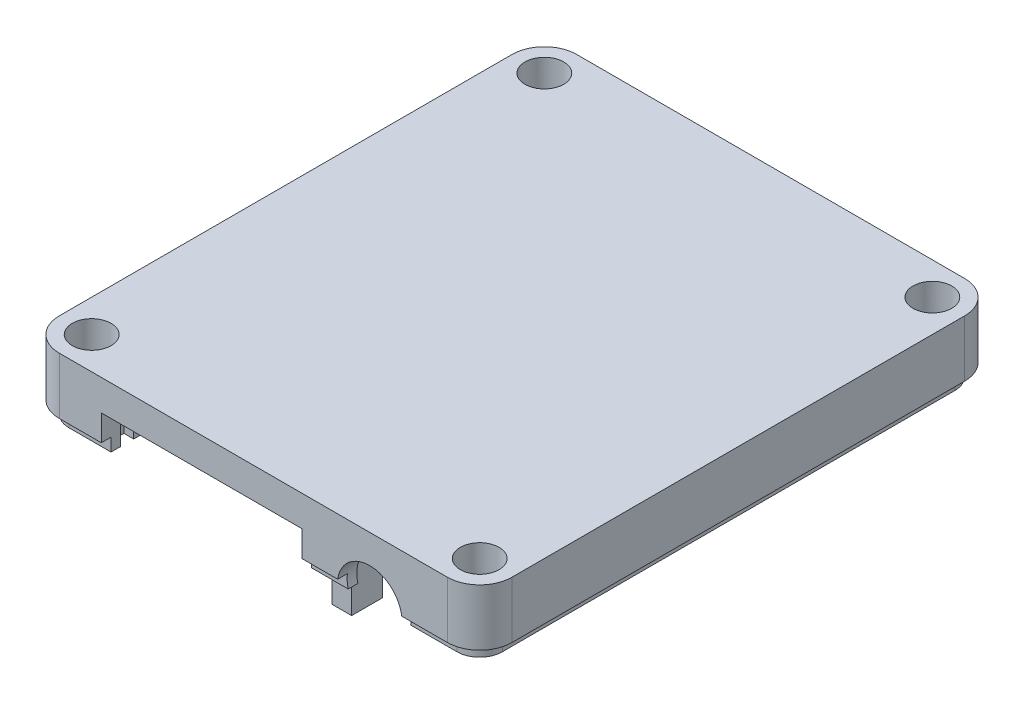
from build123d import *

# Parameters (mm, degrees)
SKETCH1_W              = 70
SKETCH1_H              = 80
BOSS_EXTRUDE1_DEPTH    = 21.5
FILLET1_R              = 5
SHELL1_T               = 3
BOSS_EXTRUDE2_REACH    = 59.335
SKETCH3_R              = 5
SPLIT2_SURFACE_1_BACK  = 109.454
SPLIT2_SURFACE_1_DEPTH = 218.908
SPLIT2_SURFACE_2_BACK  = 109.454
SPLIT2_SURFACE_2_DEPTH = 218.908
SKETCH4_R              = 1
CUT_EXTRUDE1_DEPTH     = 58.334544561
SKETCH6_OUTSIDE_W      = 93.69
SKETCH6_OUTSIDE_H      = 103.69
CUT_EXTRUDE3_DEPTH     = 2
BOSS_EXTRUDE3_START    = 1.8
BOSS_EXTRUDE3_DEPTH    = 1.8
SKETCH8_R              = 5.5
CUT_EXTRUDE4_DEPTH     = 10
SKETCH9_R              = 5
SKETCH9_W              = 20
SKETCH9_H              = 12
CUT_EXTRUDE5_DEPTH     = 10
BOSS_EXTRUDE4_DEPTH    = 7.75
SKETCH5_R              = 3
CUT_EXTRUDE2_DEPTH     = 7.75
SKETCH12_W             = 31
SKETCH12_H             = 12
CUT_EXTRUDE6_DEPTH     = 10
BOSS_EXTRUDE5_DEPTH    = 5


with BuildPart() as part:
    # Sketch1 → Boss-Extrude1 (new body)
    with BuildSketch(Plane(origin=(0, 0, 0), x_dir=(1, 0, 0), z_dir=(0, 1, 0))):
        Rectangle(SKETCH1_W, SKETCH1_H)
    extrude(amount=BOSS_EXTRUDE1_DEPTH)

    # Fillet1
    fillet1_edges = [part.edges().sort_by_distance(p)[0] for p in [
        (-35, 10.75, -40),
        (35, 10.75, -40),
        (35, 10.75, 40),
        (-35, 10.75, 40),
    ]]
    fillet(fillet1_edges, radius=FILLET1_R)

    # Shell1 (no face opened: a closed hollow body)
    add(offset(amount=-SHELL1_T, mode=Mode.PRIVATE), mode=Mode.SUBTRACT)

    # Sketch3 → Boss-Extrude2 (add, up to next)
    with BuildSketch(Plane(origin=(0, 21.5, 0), x_dir=(1, 0, 0), z_dir=(0, 1, 0)), mode=Mode.PRIVATE) as boss_extrude2_sk1:
        with Locations((-30, 35)):
            Circle(SKETCH3_R)
    boss_extrude2_tool1 = extrude(boss_extrude2_sk1.sketch, amount=-BOSS_EXTRUDE2_REACH, mode=Mode.PRIVATE) - part.part
    # Sketch3 → Boss-Extrude2 (add, up to next)
    with BuildSketch(Plane(origin=(0, 21.5, 0), x_dir=(1, 0, 0), z_dir=(0, 1, 0)), mode=Mode.PRIVATE) as boss_extrude2_sk2:
        with Locations((30, 35)):
            Circle(SKETCH3_R)
    boss_extrude2_tool2 = extrude(boss_extrude2_sk2.sketch, amount=-BOSS_EXTRUDE2_REACH, mode=Mode.PRIVATE) - part.part
    # Sketch3 → Boss-Extrude2 (add, up to next)
    with BuildSketch(Plane(origin=(0, 21.5, 0), x_dir=(1, 0, 0), z_dir=(0, 1, 0)), mode=Mode.PRIVATE) as boss_extrude2_sk3:
        with Locations((30, -35)):
            Circle(SKETCH3_R)
    boss_extrude2_tool3 = extrude(boss_extrude2_sk3.sketch, amount=-BOSS_EXTRUDE2_REACH, mode=Mode.PRIVATE) - part.part
    # Sketch3 → Boss-Extrude2 (add, up to next)
    with BuildSketch(Plane(origin=(0, 21.5, 0), x_dir=(1, 0, 0), z_dir=(0, 1, 0)), mode=Mode.PRIVATE) as boss_extrude2_sk4:
        with Locations((-30, -35)):
            Circle(SKETCH3_R)
    boss_extrude2_tool4 = extrude(boss_extrude2_sk4.sketch, amount=-BOSS_EXTRUDE2_REACH, mode=Mode.PRIVATE) - part.part
    add(boss_extrude2_tool1.solids().sort_by_distance((-30, 21.5, -35))[0])
    add(boss_extrude2_tool2.solids().sort_by_distance((30, 21.5, -35))[0])
    add(boss_extrude2_tool3.solids().sort_by_distance((30, 21.5, 35))[0])
    add(boss_extrude2_tool4.solids().sort_by_distance((-30, 21.5, 35))[0])


with BuildPart() as body_2:
    # Split2: the piece behind the surface
    add(part.part)
    # Split2 surface: a surface, the sketch's curves swept straight by 218.908 mm
    with BuildLine(Plane(origin=(0, 0, 0), x_dir=(0, 0, -1), z_dir=(1, 0, 0)).offset(-SPLIT2_SURFACE_1_BACK), mode=Mode.PRIVATE) as split2_surface_1_path:
        Line((-40, 10.75), (51.562362236, 10.75))
    split2_surface_1 = Shell.extrude(split2_surface_1_path.wire(), (1 * SPLIT2_SURFACE_1_DEPTH, 0 * SPLIT2_SURFACE_1_DEPTH, 0 * SPLIT2_SURFACE_1_DEPTH))
    split(bisect_by=split2_surface_1, keep=Keep.BOTTOM)


with BuildPart() as part_1:
    add(part.part)

    # Split2: split by a surface, the side it looks to stays
    # Split2 surface: a surface, the sketch's curves swept straight by 218.908 mm
    with BuildLine(Plane(origin=(0, 0, 0), x_dir=(0, 0, -1), z_dir=(1, 0, 0)).offset(-SPLIT2_SURFACE_2_BACK), mode=Mode.PRIVATE) as split2_surface_2_path:
        Line((-40, 10.75), (51.562362236, 10.75))
    split2_surface_2 = Shell.extrude(split2_surface_2_path.wire(), (1 * SPLIT2_SURFACE_2_DEPTH, 0 * SPLIT2_SURFACE_2_DEPTH, 0 * SPLIT2_SURFACE_2_DEPTH))
    split(bisect_by=split2_surface_2, keep=Keep.TOP)


with BuildPart() as cut_extrude1_tool:
    # Sketch4 → Cut-Extrude1 (new, through all)
    with BuildSketch(Plane(origin=(0, 21.5, 0), x_dir=(1, 0, 0), z_dir=(0, 1, 0))):
        with Locations(Location((-30, 35, 0), (0, 0, 270))):
            Circle(SKETCH4_R)
        with Locations(Location((30, 35, 0), (0, 0, 270))):
            Circle(SKETCH4_R)
        with Locations(Location((30, -35, 0), (0, 0, 270))):
            Circle(SKETCH4_R)
        with Locations(Location((-30, -35, 0), (0, 0, 270))):
            Circle(SKETCH4_R)
    extrude(amount=-CUT_EXTRUDE1_DEPTH)


with BuildPart() as part_2:
    add(part_1.part)

    # Cut-Extrude1: cut by cut_extrude1_tool
    add(cut_extrude1_tool.part, mode=Mode.SUBTRACT)

    # Sketch6 outside → Cut-Extrude3 (cut)
    with BuildSketch(Plane.XZ.offset(-10.75)):
        Rectangle(SKETCH6_OUTSIDE_W, SKETCH6_OUTSIDE_H)
        with BuildLine():
            Line((-30, -38.5), (30, -38.5))
            ThreePointArc((30, -38.5), (32.474873734, -37.474873734), (33.5, -35))
            Line((33.5, -35), (33.5, 35))
            ThreePointArc((33.5, 35), (32.474873734, 37.474873734), (30, 38.5))
            Line((30, 38.5), (-30, 38.5))
            ThreePointArc((-30, 38.5), (-32.474873734, 37.474873734), (-33.5, 35))
            Line((-33.5, 35), (-33.5, -35))
            ThreePointArc((-33.5, -35), (-32.474873734, -37.474873734), (-30, -38.5))
        make_face(mode=Mode.SUBTRACT)
    extrude(amount=-CUT_EXTRUDE3_DEPTH, mode=Mode.SUBTRACT)


with BuildPart() as body_2_1:
    add(body_2.part)

    # Cut-Extrude1: cut by cut_extrude1_tool
    add(cut_extrude1_tool.part, mode=Mode.SUBTRACT)

    # Sketch7 → Boss-Extrude3 (add)
    with BuildSketch(Plane(origin=(0, 10.75, 0), x_dir=(1, 0, 0), z_dir=(0, 1, 0)).offset(BOSS_EXTRUDE3_START)):
        with BuildLine():
            Line((-30, 40), (30, 40))
            ThreePointArc((30, 40), (33.535533906, 38.535533906), (35, 35))
            Line((35, 35), (35, -35))
            ThreePointArc((35, -35), (33.535533906, -38.535533906), (30, -40))
            Line((30, -40), (-30, -40))
            ThreePointArc((-30, -40), (-33.535533906, -38.535533906), (-35, -35))
            Line((-35, -35), (-35, 35))
            ThreePointArc((-35, 35), (-33.535533906, 38.535533906), (-30, 40))
        make_face()
        with BuildLine():
            Line((30, 38.7), (-30, 38.7))
            ThreePointArc((-30, 38.7), (-32.61629509, 37.61629509), (-33.7, 35))
            Line((-33.7, 35), (-33.7, -35))
            ThreePointArc((-33.7, -35), (-32.61629509, -37.61629509), (-30, -38.7))
            Line((-30, -38.7), (30, -38.7))
            ThreePointArc((30, -38.7), (32.61629509, -37.61629509), (33.7, -35))
            Line((33.7, -35), (33.7, 35))
            ThreePointArc((33.7, 35), (32.61629509, 37.61629509), (30, 38.7))
        make_face(mode=Mode.SUBTRACT)
    extrude(amount=-BOSS_EXTRUDE3_DEPTH)


with BuildPart() as cut_extrude4_tool:
    # Sketch8 → Cut-Extrude4 (new body)
    with BuildSketch(Plane.ZY.offset(35)):
        with Locations((-20, 12.05)):
            Circle(SKETCH8_R)
    extrude(amount=-CUT_EXTRUDE4_DEPTH)


with BuildPart() as part_3:
    add(part_2.part)

    # Cut-Extrude4: cut by cut_extrude4_tool
    add(cut_extrude4_tool.part, mode=Mode.SUBTRACT)


with BuildPart() as body_2_2:
    add(body_2_1.part)

    # Cut-Extrude4: cut by cut_extrude4_tool
    add(cut_extrude4_tool.part, mode=Mode.SUBTRACT)


with BuildPart() as cut_extrude5_tool:
    # Sketch9 → Cut-Extrude5 (new body)
    with BuildSketch(Plane.XY.offset(40)):
        with Locations((18, 12.05)):
            Circle(SKETCH9_R)
        with Locations((-10, 10.75)):
            Rectangle(SKETCH9_W, SKETCH9_H)
    extrude(amount=-CUT_EXTRUDE5_DEPTH)


with BuildPart() as part_4:
    add(part_3.part)

    # Cut-Extrude5: cut by cut_extrude5_tool
    add(cut_extrude5_tool.part, mode=Mode.SUBTRACT)

    # Sketch11 → Boss-Extrude4 (add)
    with BuildSketch(Plane.XZ.offset(-18.5)):
        Polygon((-28, 38.5), (12, 38.5), (12, 32), (7.5, 32), (7.5, 35), (9, 35), (9, 37), (-25, 37), (-25, 35), (-23.5, 35), (-23.5, 32), (-28, 32), align=None)
    extrude(amount=BOSS_EXTRUDE4_DEPTH)

    # Sketch5 → Cut-Extrude2 (cut)
    with BuildSketch(Plane(origin=(0, 21.5, 0), x_dir=(1, 0, 0), z_dir=(0, 1, 0))):
        with Locations(Location((-30, 35, 0), (0, 0, 270))):
            Circle(SKETCH5_R)
        with Locations(Location((30, 35, 0), (0, 0, 270))):
            Circle(SKETCH5_R)
        with Locations(Location((30, -35, 0), (0, 0, 270))):
            Circle(SKETCH5_R)
        with Locations(Location((-30, -35, 0), (0, 0, 270))):
            Circle(SKETCH5_R)
    extrude(amount=-CUT_EXTRUDE2_DEPTH, mode=Mode.SUBTRACT)


with BuildPart() as body_2_3:
    add(body_2_2.part)

    # Cut-Extrude5: cut by cut_extrude5_tool
    add(cut_extrude5_tool.part, mode=Mode.SUBTRACT)


with BuildPart() as cut_extrude6_tool:
    # Sketch12 → Cut-Extrude6 (new body)
    with BuildSketch(Plane(origin=(0, 0, 37), x_dir=(-1, 0, 0), z_dir=(0, 0, -1))):
        with Locations((8, 10.75)):
            Rectangle(SKETCH12_W, SKETCH12_H)
    extrude(amount=-CUT_EXTRUDE6_DEPTH)


with BuildPart() as part_5:
    add(part_4.part)

    # Cut-Extrude6: cut by cut_extrude6_tool
    add(cut_extrude6_tool.part, mode=Mode.SUBTRACT)

    # Sketch14 → Boss-Extrude5 (add)
    with BuildSketch(Plane.XZ.offset(-10.75)):
        Polygon((12, 36.8), (9, 36.8), (9, 35), (7.5, 35), (7.5, 32), (12, 32), align=None)
    extrude(amount=BOSS_EXTRUDE5_DEPTH)


with BuildPart() as body_2_4:
    add(body_2_3.part)

    # Cut-Extrude6: cut by cut_extrude6_tool
    add(cut_extrude6_tool.part, mode=Mode.SUBTRACT)


solid = part_5.part
